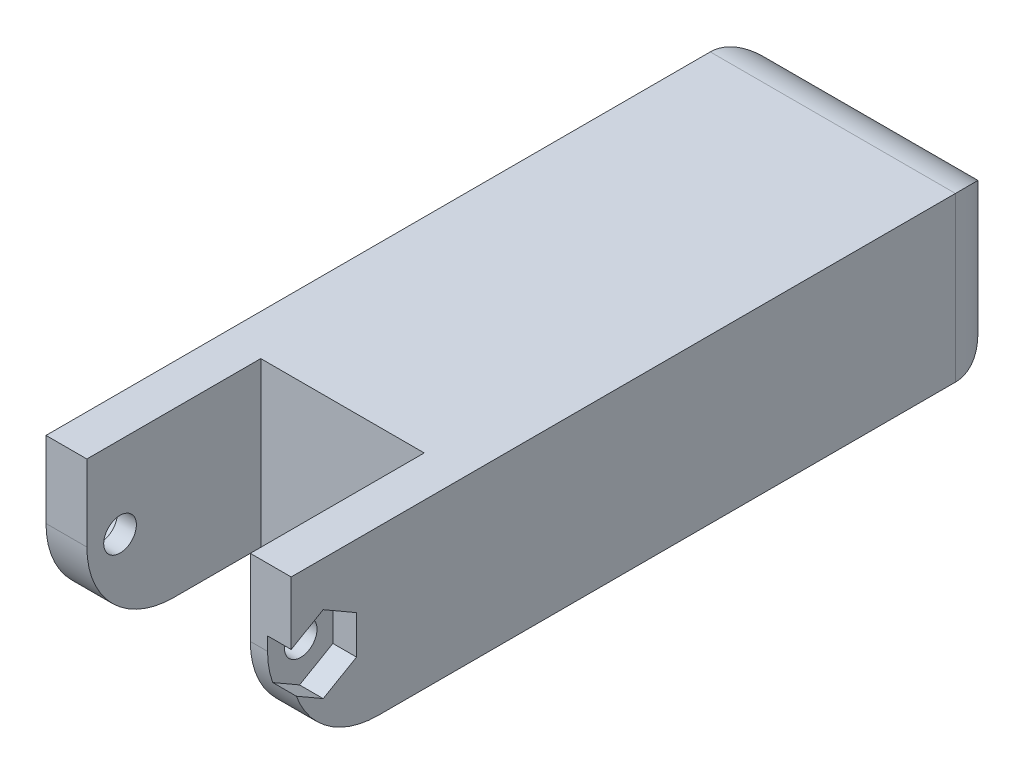
from build123d import *

# Parameters (mm, degrees)
SKETCH1_W           = 22.5
SKETCH1_H           = 65.96
BOSS_EXTRUDE1_DEPTH = 35
SKETCH2_W           = 15
SKETCH2_H           = 15.96
CUT_EXTRUDE1_DEPTH  = 35
SKETCH4_R           = 1.5
CUT_EXTRUDE2_DEPTH  = 35
SKETCH5_R           = 2.65
CUT_EXTRUDE3_DEPTH  = 2
CUT_EXTRUDE4_DEPTH  = 2.17
CUT_EXTRUDE5_DEPTH  = 27.17
FILLET1_R           = 8
FILLET2_R           = 5


with BuildPart() as part:
    # Sketch1 → Boss-Extrude1 (new body)
    with BuildSketch(Plane(origin=(0, 0, 0), x_dir=(1, 0, 0), z_dir=(0, 1, 0))):
        with Locations((0, 17.02)):
            Rectangle(SKETCH1_W, SKETCH1_H)
    extrude(amount=BOSS_EXTRUDE1_DEPTH)

    # Sketch2 → Cut-Extrude1 (cut)
    with BuildSketch(Plane(origin=(0, 35, 0), x_dir=(1, 0, 0), z_dir=(0, 1, 0))):
        with Locations((0, -7.98)):
            Rectangle(SKETCH2_W, SKETCH2_H)
    extrude(amount=-CUT_EXTRUDE1_DEPTH, mode=Mode.SUBTRACT)

    # Sketch4 → Cut-Extrude2 (cut)
    with BuildSketch(Plane.ZY.offset(11.25)):
        with Locations((12.915476268, 17.5)):
            Circle(SKETCH4_R)
    extrude(amount=-CUT_EXTRUDE2_DEPTH, mode=Mode.SUBTRACT)

    # Sketch5 → Cut-Extrude3 (cut)
    with BuildSketch(Plane.ZY.offset(11.25)):
        with Locations((12.915476268, 17.5)):
            Circle(SKETCH5_R)
    extrude(amount=-CUT_EXTRUDE3_DEPTH, mode=Mode.SUBTRACT)

    # Sketch6 → Cut-Extrude4 (cut)
    with BuildSketch(Plane(origin=(11.25, 0, 0), x_dir=(0, 0, -1), z_dir=(1, 0, 0))):
        Polygon((-13.021785536, 13.863620316), (-9.961785536, 15.630312139), (-9.961785536, 19.163695787), (-13.021785536, 20.930387611), (-16.081785536, 19.163695787), (-16.081785536, 15.630312139), align=None)
    extrude(amount=-CUT_EXTRUDE4_DEPTH, mode=Mode.SUBTRACT)

    # Sketch7 → Cut-Extrude5 (cut)
    with BuildSketch(Plane(origin=(11.25, 0, 0), x_dir=(0, 0, -1), z_dir=(1, 0, 0))):
        Polygon((-15.96, 10), (-15.96, 0), (71.192312273, 0), (70.711592722, 35), (-15.96, 35), (-15.96, 25), (54.137148325, 25), (54.137148325, 10), align=None)
    extrude(amount=-CUT_EXTRUDE5_DEPTH, mode=Mode.SUBTRACT)

    # Fillet1
    fillet1_edges = [part.edges().sort_by_distance(p)[0] for p in [
        (9.375, 10, 15.96),
        (-9.375, 10, 15.96),
    ]]
    fillet(fillet1_edges, radius=FILLET1_R)

    # Fillet2
    fillet2_edges = [part.edges().sort_by_distance(p)[0] for p in [
        (11.25, 17.5, -50),
        (-11.25, 17.5, -50),
        (0, 10, -50),
        (0, 25, -50),
    ]]
    fillet(fillet2_edges, radius=FILLET2_R)


solid = part.part
